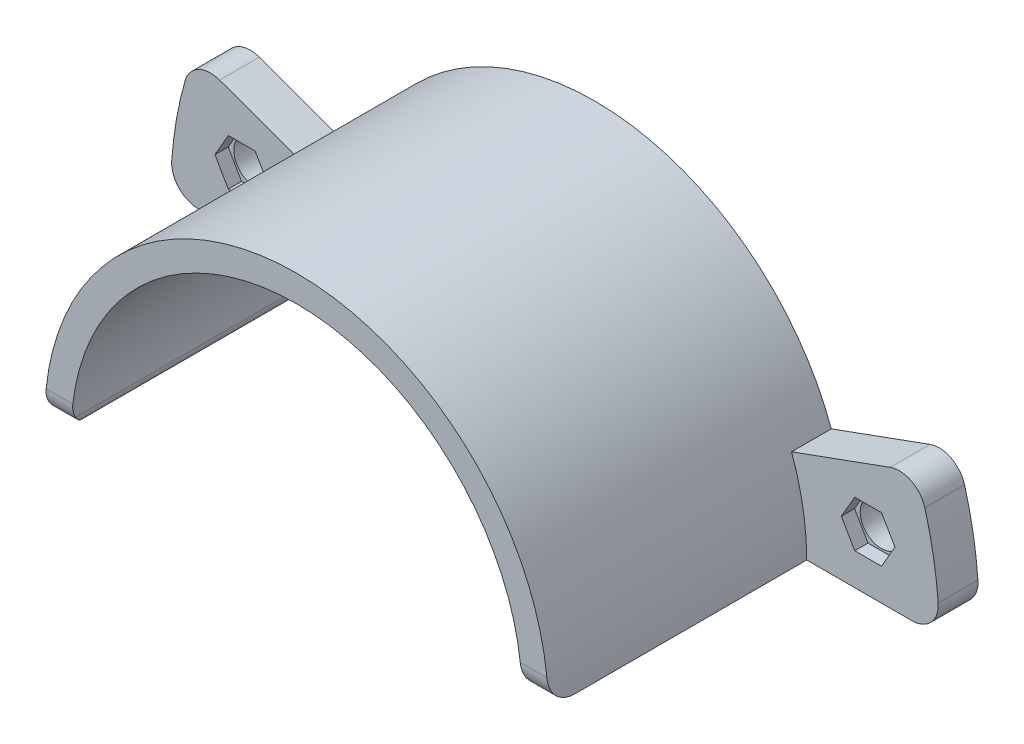
from build123d import *
from OCP.BRepFilletAPI import BRepFilletAPI_MakeFillet

# Parameters (mm, degrees)
SKETCH2_R             = 1.6
BOSS_EXTRUDE1_DEPTH   = 3
BOSS_EXTRUDE1_2_DEPTH = 3
BOSS_EXTRUDE2_DEPTH   = 22.5
FILLET1_R1            = 2
FILLET1_R2            = 1
CUT_EXTRUDE2_DEPTH    = 1


with BuildPart() as part:
    # Sketch2 → Boss-Extrude1 (new body)
    with BuildSketch(Plane.XY):
        with BuildLine():
            ThreePointArc((-19, 0), (-18.711347307, 3.299315376), (-17.854159795, 6.498382723))
            Line((-17.854159795, 6.498382723), (-27.251086003, 9.918584156))
            ThreePointArc((-27.251086003, 9.918584156), (-28.559424837, 5.035797152), (-29, 0))
            Line((-29, 0), (-19, 0))
        make_face()
        with Locations((-23.635386072, 4.167556264)):
            Circle(SKETCH2_R, mode=Mode.SUBTRACT)
    extrude(amount=BOSS_EXTRUDE1_DEPTH)



with BuildPart() as body_2:
    # Sketch2 → Boss-Extrude1 2 (new body)
    with BuildSketch(Plane.XY):
        with BuildLine():
            ThreePointArc((17.854159795, 6.498382723), (18.711347307, 3.299315376), (19, 0))
            Line((19, 0), (29, 0))
            ThreePointArc((29, 0), (28.559424837, 5.035797152), (27.251086003, 9.918584156))
            Line((27.251086003, 9.918584156), (17.854159795, 6.498382723))
        make_face()
        with Locations((23.635386072, 4.167556264)):
            Circle(SKETCH2_R, mode=Mode.SUBTRACT)
    extrude(amount=BOSS_EXTRUDE1_2_DEPTH)


with BuildPart() as part_1:
    add(part.part)

    add(body_2.part)  # Boss-Extrude2 merges body 2
    # Sketch2<3> → Boss-Extrude2 (add)
    with BuildSketch(Plane.XY):
        with BuildLine():
            Line((-19, 0), (-17, 0))
            ThreePointArc((-17, 0), (0, 17), (17, 0))
            Line((17, 0), (19, 0))
            ThreePointArc((19, 0), (18.711347307, 3.299315376), (17.854159795, 6.498382723))
            ThreePointArc((17.854159795, 6.498382723), (0, 19), (-17.854159795, 6.498382723))
            ThreePointArc((-17.854159795, 6.498382723), (-18.711347307, 3.299315376), (-19, 0))
        make_face()
    extrude(amount=BOSS_EXTRUDE2_DEPTH)

    # Fillet1: one fillet with a radius per group of edges: ONE call of the kernel's fillet builder (fillet() takes one radius for all edges)
    fillet1_edges_1 = [part_1.edges().sort_by_distance(p)[0] for p in [
        (-29, 0, 1.5),
        (-27.251086003, 9.918584156, 1.5),
        (-18, 0, 22.5),
        (18, 0, 22.5),
        (29, 0, 1.5),
        (27.251086003, 9.918584156, 1.5),
    ]]
    fillet1_edges_2 = [part_1.edges().sort_by_distance(p)[0] for p in [
        (-17, 0, 11.25),
        (17, 0, 11.25),
    ]]
    fillet1 = BRepFilletAPI_MakeFillet(part_1.part.solid().wrapped)
    for e in fillet1_edges_1:
        fillet1.Add(FILLET1_R1, e.wrapped)
    for e in fillet1_edges_2:
        fillet1.Add(FILLET1_R2, e.wrapped)
    add(Compound.cast(fillet1.Shape()), mode=Mode.REPLACE)

    # Sketch4 → Cut-Extrude2 (cut)
    with BuildSketch(Plane.XY.offset(3)):
        Polygon((-21.61466013, 4.167556264), (-22.625023101, 5.917556264), (-24.645749043, 5.917556264), (-25.656112014, 4.167556264), (-24.645749043, 2.417556264), (-22.625023101, 2.417556264), align=None)
        Polygon((25.656112014, 4.167556264), (24.645749043, 5.917556264), (22.625023101, 5.917556264), (21.61466013, 4.167556264), (22.625023101, 2.417556264), (24.645749043, 2.417556264), align=None)
    extrude(amount=-CUT_EXTRUDE2_DEPTH, mode=Mode.SUBTRACT)


solid = part_1.part
